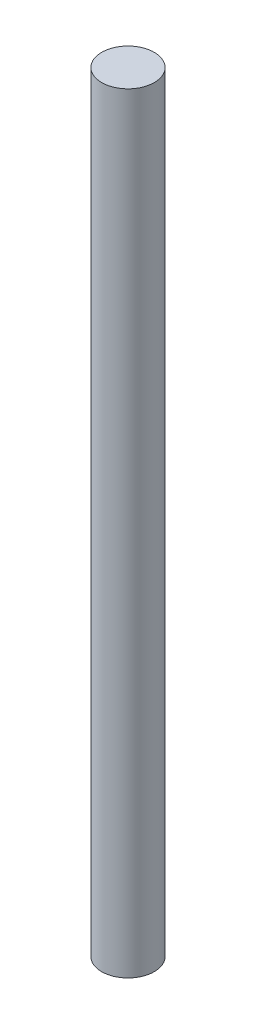
from build123d import *

# Parameters (mm, degrees)
SKETCH1_R           = 1.125
BOSS_EXTRUDE1_DEPTH = 16.5


with BuildPart() as part:
    # Sketch1 → Boss-Extrude1 (new, symmetric)
    with BuildSketch(Plane(origin=(0, 0, 0), x_dir=(1, 0, 0), z_dir=(0, 1, 0))):
        with Locations(Location((0, 0, 0), (0, 0, 270))):
            Circle(SKETCH1_R)
    extrude(amount=BOSS_EXTRUDE1_DEPTH, both=True)


solid = part.part
